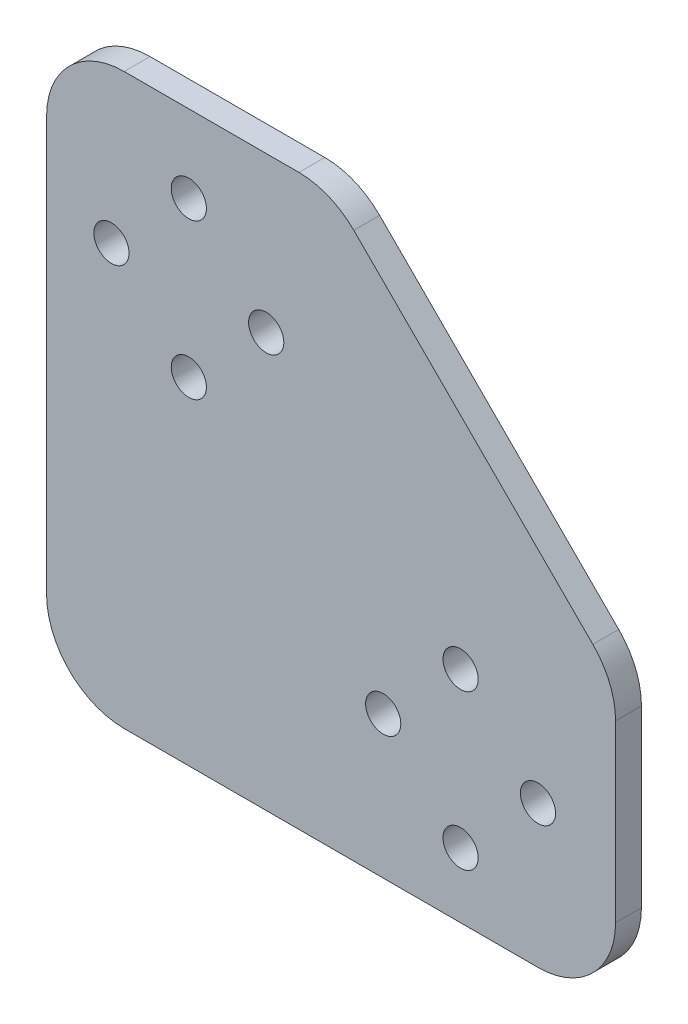
from build123d import *

# Parameters (mm, degrees)
SKETCH1_R           = 2.159
BOSS_EXTRUDE1_DEPTH = 1.5875
FILLET1_R           = 9.525


with BuildPart() as part:
    # Sketch1 → Boss-Extrude1 (new, symmetric)
    with BuildSketch(Plane.XY):
        Polygon((0, 0), (69.85, 0), (69.85, 34.925), (34.925, 69.85), (0, 69.85), align=None)
        with Locations((50.825, 26.9625)):
            Circle(SKETCH1_R, mode=Mode.SUBTRACT)
        with Locations(Location((26.9625, 50.825, 0), (0, 0, 180))):
            Circle(SKETCH1_R, mode=Mode.SUBTRACT)
        with Locations((50.825, 7.9625)):
            Circle(SKETCH1_R, mode=Mode.SUBTRACT)
        with Locations(Location((7.9625, 50.825, 0), (0, 0, 180))):
            Circle(SKETCH1_R, mode=Mode.SUBTRACT)
        with Locations((41.325, 17.4625)):
            Circle(SKETCH1_R, mode=Mode.SUBTRACT)
        with Locations(Location((17.4625, 41.325, 0), (0, 0, 180))):
            Circle(SKETCH1_R, mode=Mode.SUBTRACT)
        with Locations((60.325, 17.4625)):
            Circle(SKETCH1_R, mode=Mode.SUBTRACT)
        with Locations(Location((17.4625, 60.325, 0), (0, 0, 180))):
            Circle(SKETCH1_R, mode=Mode.SUBTRACT)
    extrude(amount=BOSS_EXTRUDE1_DEPTH, both=True)

    # Fillet1
    fillet1_edges = [part.edges().sort_by_distance(p)[0] for p in [
        (0, 69.85, 0),
        (34.925, 69.85, 0),
        (69.85, 34.925, 0),
        (69.85, 0, 0),
        (0, 0, 0),
    ]]
    fillet(fillet1_edges, radius=FILLET1_R)


solid = part.part
